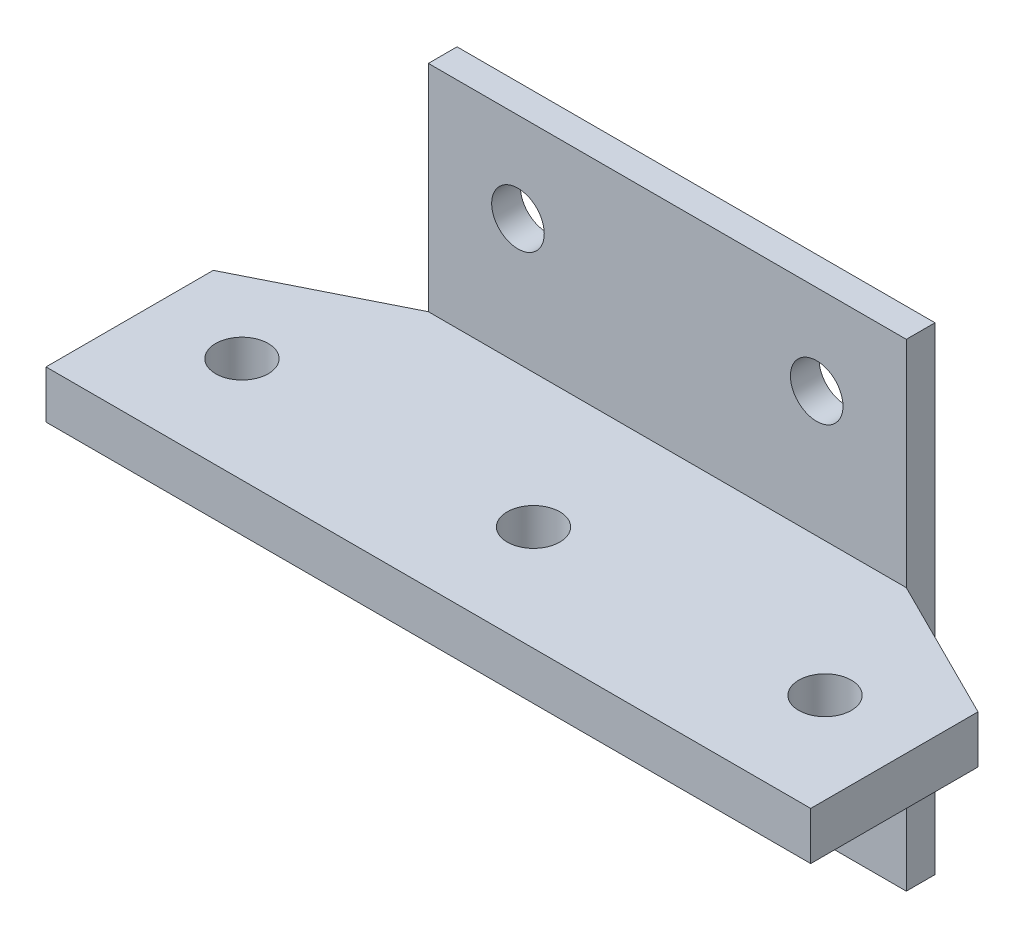
from build123d import *

# Parameters (mm, degrees)
SKETCH_1_W                  = 200
SKETCH_1_H                  = 200
EXTRUDE_1_DEPTH             = 12
SKETCH_2_R                  = 11
CUT_EXTRUDE_2_DEPTH         = 284.097156468
PATTERN_LINEAR_1_COUNT      = 2
PATTERN_LINEAR_1_PITCH      = 125
PATTERN_LINEAR_1_COUNT_DIR2 = 2
PATTERN_LINEAR_1_PITCH_DIR2 = 125
SKETCH_3_W                  = 320
SKETCH_3_H                  = 20
EXTRUDE_3_DEPTH             = 100
CUT_EXTRUDE_4_DEPTH         = 304.716973513
SKETCH_6_R                  = 11
CUT_EXTRUDE_6_DEPTH         = 304.716973513
PATTERN_LINEAR_3_COUNT      = 3
PATTERN_LINEAR_3_PITCH      = 122


with BuildPart() as part:
    # 草图1 → 拉伸1 (new body)
    with BuildSketch(Plane.XY):
        with Locations((100, 100)):
            Rectangle(SKETCH_1_W, SKETCH_1_H)
    extrude(amount=EXTRUDE_1_DEPTH)

    # 草图2 → 拉伸2 (cut, through all)
    with BuildSketch(Plane.XY.offset(12)):
        with Locations((37.5, 37.5)):
            Circle(SKETCH_2_R)
    cut_extrude_2 = extrude(amount=-CUT_EXTRUDE_2_DEPTH, mode=Mode.SUBTRACT)

    # 阵列(线性)1: Cut-Extrude 2 2 × 2
    with Locations(*[(i * PATTERN_LINEAR_1_PITCH, j * PATTERN_LINEAR_1_PITCH_DIR2, 0) for i in range(PATTERN_LINEAR_1_COUNT) for j in range(PATTERN_LINEAR_1_COUNT_DIR2) if (i, j) != (0, 0)]):
        add(cut_extrude_2, mode=Mode.SUBTRACT)

    # 草图3 → 拉伸3 (add)
    with BuildSketch(Plane.XY.offset(12)):
        with Locations((100, 100)):
            Rectangle(SKETCH_3_W, SKETCH_3_H)
    extrude(amount=EXTRUDE_3_DEPTH)

    # 草图4 → 拉伸4 (cut, through all)
    with BuildSketch(Plane.XZ.offset(-90)):
        Polygon((200, 12), (260, 42), (260, 12), align=None)
        Polygon((-60, 42), (0, 12), (-60, 12), align=None)
    extrude(amount=-CUT_EXTRUDE_4_DEPTH, mode=Mode.SUBTRACT)

    # 草图6 → 拉伸6 (cut, through all)
    with BuildSketch(Plane.XZ.offset(-90)):
        with Locations(Location((-22, 68, 0), (0, 0, 270))):
            Circle(SKETCH_6_R)
    cut_extrude_6 = extrude(amount=-CUT_EXTRUDE_6_DEPTH, mode=Mode.SUBTRACT)

    # 阵列(线性)3: 拉伸6 ×3
    with Locations(*[(i * PATTERN_LINEAR_3_PITCH, 0, 0) for i in range(1, PATTERN_LINEAR_3_COUNT)]):
        add(cut_extrude_6, mode=Mode.SUBTRACT)


solid = part.part
